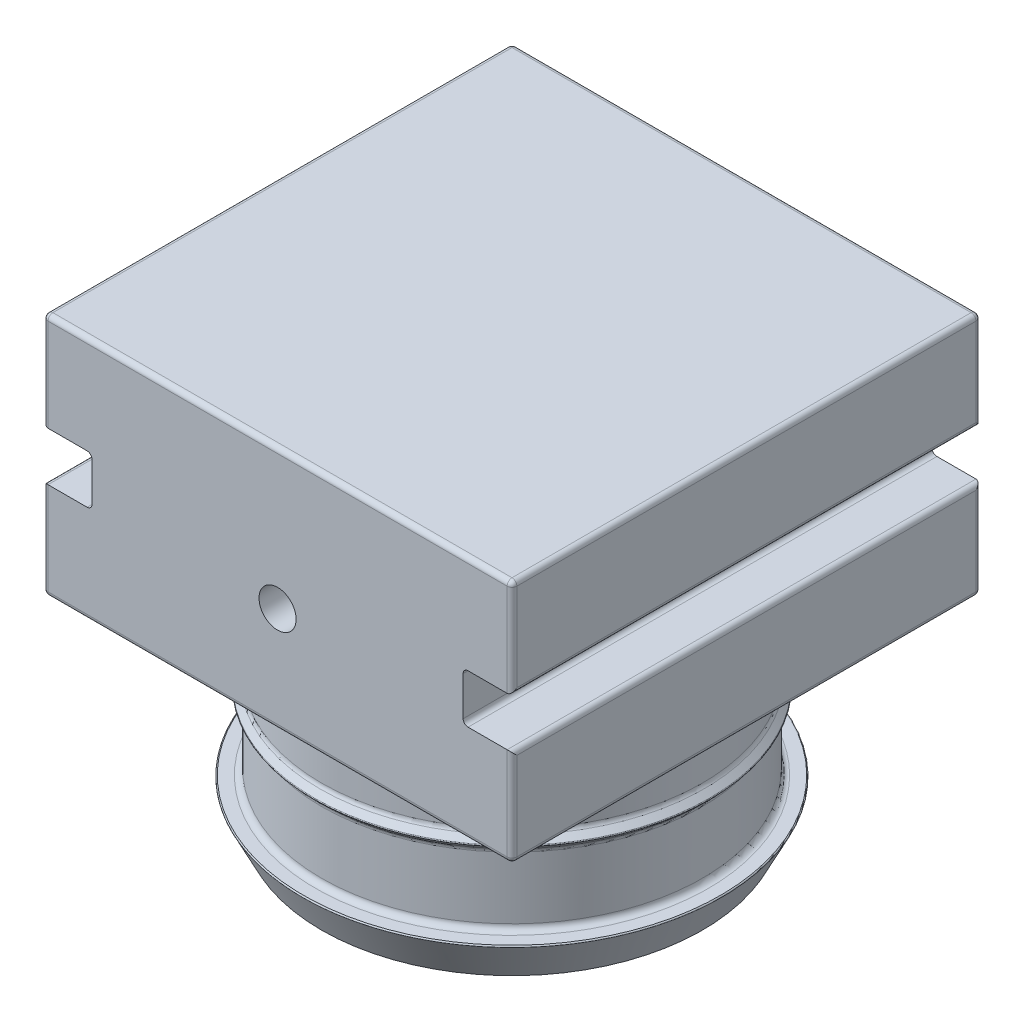
from build123d import *

# Parameters (mm, degrees)
SKETCH2_W                  = 48
SKETCH2_H                  = 48
BOSS_EXTRUDE1_DEPTH        = 25
SKETCH3_W                  = 5
SKETCH3_H                  = 5
CUT_EXTRUDE2_DEPTH         = 63.636171658
SKETCH4_R                  = 2.41
CUT_EXTRUDE3_DEPTH         = 33
F_10_24_TAPPED_HOLE1_D     = 3.7973
F_10_24_TAPPED_HOLE1_DEPTH = 23
F_10_24_TAPPED_HOLE1_TIP   = 1.140824014
FILLET1_R                  = 0.1
FILLET2_R                  = 0.6
FILLET3_R                  = 0.5


with BuildPart() as part:
    # Sketch1 → Revolve1 (revolve)
    with BuildSketch(Plane.XY, mode=Mode.PRIVATE) as revolve1_sk:
        Polygon((0, -12.7), (19.5, -12.7), (21.5, -8.7), (19.5, -8.7), (19.5, -1.49375), (20.29375, -0.7), (19.5, 0.09375), (19.5, 7.3), (0, 7.3), align=None)
    revolve(revolve1_sk.sketch.rotate(Axis((0, 1017.662299771, 0), (0, -1, 0)), 90), axis=Axis((0, 1017.662299771, 0), (0, -1, 0)))

    # Sketch2 → Boss-Extrude1 (add)
    with BuildSketch(Plane(origin=(0, 7.3, 0), x_dir=(1, 0, 0), z_dir=(0, 1, 0))):
        Rectangle(SKETCH2_W, SKETCH2_H)
    extrude(amount=BOSS_EXTRUDE1_DEPTH)

    # Sketch3 → Cut-Extrude2 (cut, through all)
    with BuildSketch(Plane.XY.offset(24)):
        with Locations((21.5, 19.8)):
            Rectangle(SKETCH3_W, SKETCH3_H)
        with Locations((-21.5, 19.8)):
            Rectangle(SKETCH3_W, SKETCH3_H)
    extrude(amount=-CUT_EXTRUDE2_DEPTH, mode=Mode.SUBTRACT)

    # Sketch4 → Cut-Extrude3 (cut)
    with BuildSketch(Plane.XZ.offset(12.7)):
        with Locations(Location((0, 0, 0), (0, 0, 270))):
            Circle(SKETCH4_R)
    extrude(amount=-CUT_EXTRUDE3_DEPTH, mode=Mode.SUBTRACT)

    # #10-24 Tapped Hole1
    with Locations(Plane.XY.offset(24)):
        with Locations((0, 18.05)):
            Hole(F_10_24_TAPPED_HOLE1_D / 2, depth=F_10_24_TAPPED_HOLE1_DEPTH)
            with Locations((0, 0, -(F_10_24_TAPPED_HOLE1_DEPTH + F_10_24_TAPPED_HOLE1_TIP / 2))):  # 118° drill point
                Cone(0, F_10_24_TAPPED_HOLE1_D / 2, F_10_24_TAPPED_HOLE1_TIP, mode=Mode.SUBTRACT)

    # Fillet1
    fillet1_edges = [part.edges().sort_by_distance(p)[0] for p in [
        (0, -0.7, -20.29375),
        (0, -8.7, -21.5),
    ]]
    fillet(fillet1_edges, radius=FILLET1_R)

    # Fillet2
    fillet2_edges = [part.edges().sort_by_distance(p)[0] for p in [
        (0, 7.3, -19.5),
        (0, 0.09375, -19.5),
        (0, -1.49375, -19.5),
        (0, -8.7, -19.5),
    ]]
    fillet(fillet2_edges, radius=FILLET2_R)

    # Fillet3
    fillet3_edges = [part.edges().sort_by_distance(p)[0] for p in [
        (-24, 7.3, 0),
        (-24, 27.3, -24),
        (0, 7.3, 24),
        (-24, 27.3, 24),
        (24, 7.3, 0),
        (24, 27.3, 24),
        (0, 7.3, -24),
        (24, 27.3, -24),
        (-24, 32.3, 0),
        (0, 32.3, 24),
        (24, 32.3, 0),
        (0, 32.3, -24),
        (-24, 12.3, -24),
        (24, 12.3, -24),
        (24, 12.3, 24),
        (-24, 12.3, 24),
        (19, 17.3, 0),
        (19, 22.3, 0),
        (24, 22.3, 0),
        (24, 17.3, 0),
        (-24, 17.3, 0),
        (-24, 22.3, 0),
        (-19, 22.3, 0),
        (-19, 17.3, 0),
    ]]
    fillet(fillet3_edges, radius=FILLET3_R)


solid = part.part
